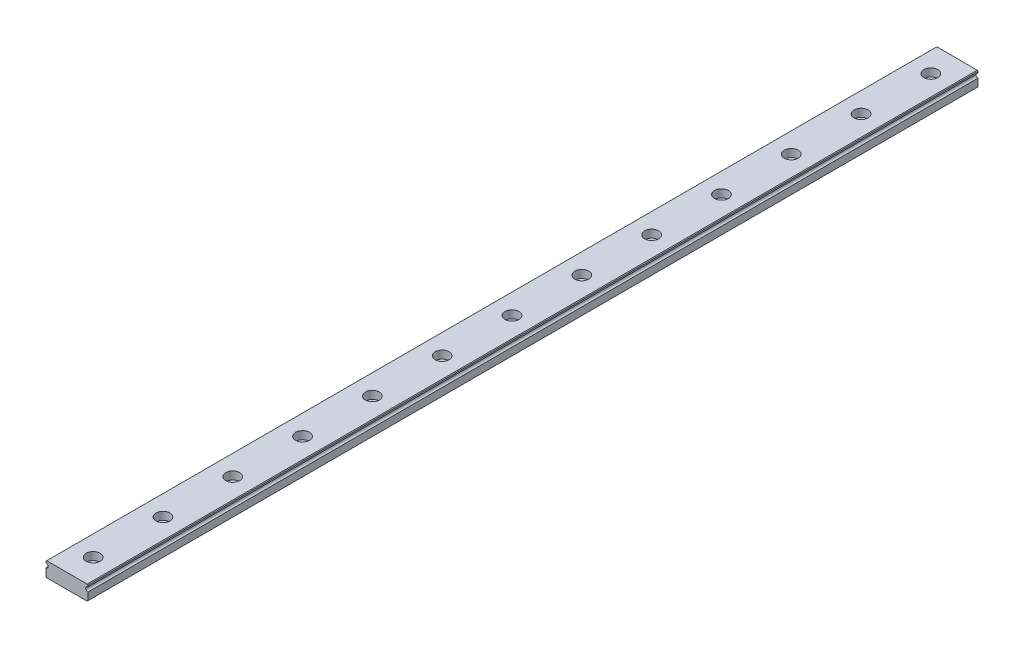
from build123d import *

# Parameters (mm, degrees)
EXTRUDE_1_DEPTH           = 510
HOLE_WIZARD_1_D           = 4.5
HOLE_WIZARD_1_CBORE_D     = 8
HOLE_WIZARD_1_CBORE_DEPTH = 4.5
PATTERN_LINEAR_1_COUNT    = 13
PATTERN_LINEAR_1_PITCH    = 40


with BuildPart() as part:
    # 草图1 → 凸台-拉伸1 (new body)
    with BuildSketch(Plane.XY):
        with BuildLine():
            Line((-12, 3), (-12, 3.85))
            Line((-12, 3.85), (-11.6, 4.25))
            Line((-11.6, 4.25), (11.6, 4.25))
            Line((11.6, 4.25), (12, 3.85))
            Line((12, 3.85), (12, 3))
            ThreePointArc((12, 3), (10.75, 1.75), (12, 0.5))
            Line((12, 0.5), (12, -3.85))
            Line((12, -3.85), (11.6, -4.25))
            Line((11.6, -4.25), (6.3, -4.25))
            ThreePointArc((6.3, -4.25), (6, -3.95), (5.7, -4.25))
            Line((5.7, -4.25), (-11.6, -4.25))
            Line((-11.6, -4.25), (-12, -3.85))
            Line((-12, -3.85), (-12, 0.5))
            ThreePointArc((-12, 0.5), (-10.75, 1.75), (-12, 3))
        make_face()
    extrude(amount=-EXTRUDE_1_DEPTH)

    # 打孔尺寸根据内六角圆柱头螺钉的类型1 (through all)
    with Locations(Plane(origin=(0, 4.25, 0), x_dir=(1, 0, 0), z_dir=(0, 1, 0))):
        with Locations((0, 15)):
            hole_wizard_1 = CounterBoreHole(HOLE_WIZARD_1_D / 2, HOLE_WIZARD_1_CBORE_D / 2, HOLE_WIZARD_1_CBORE_DEPTH)

    # 阵列(线性)1: 打孔尺寸根据内六角圆柱头螺钉的类型1 ×13
    with Locations(*[(0, 0, -i * PATTERN_LINEAR_1_PITCH) for i in range(1, PATTERN_LINEAR_1_COUNT)]):
        add(hole_wizard_1, mode=Mode.SUBTRACT)


solid = part.part
